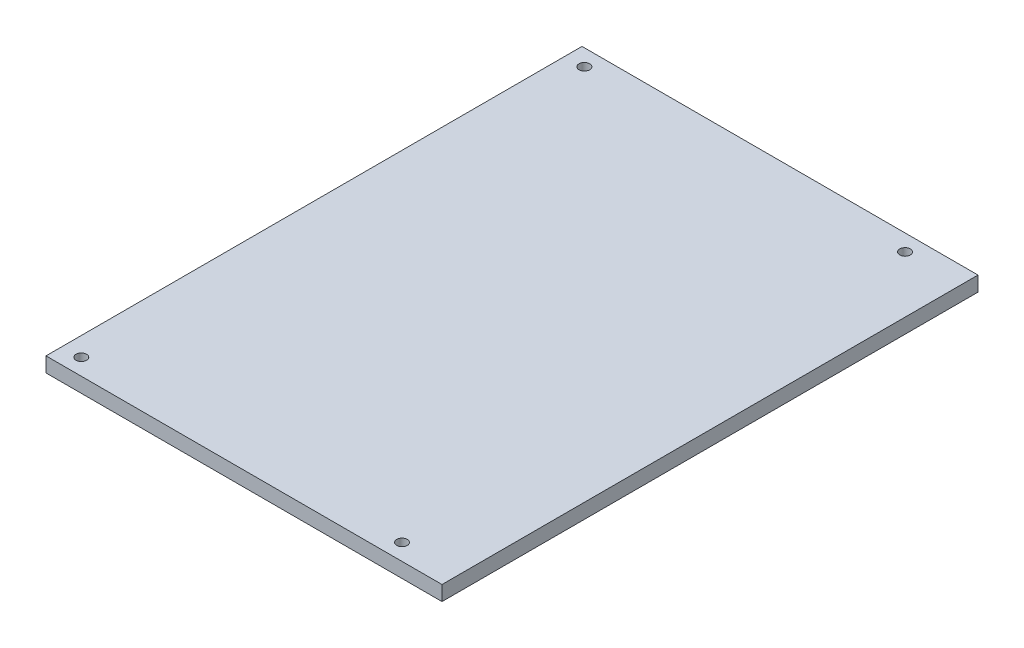
from build123d import *

# Parameters (mm, degrees)
SKETCH1_W           = 267.22
SKETCH1_H           = 361.68
SKETCH1_R           = 3.57
BOSS_EXTRUDE1_DEPTH = 10


with BuildPart() as part:
    # Sketch1 → Boss-Extrude1 (new body)
    with BuildSketch(Plane(origin=(0, 0, 0), x_dir=(1, 0, 0), z_dir=(0, 1, 0))):
        with Locations((-5.948680203, -14.948274112)):
            Rectangle(SKETCH1_W, SKETCH1_H)
        with Locations(Location((-126.858680203, -184.675774112, 0), (0, 0, 270))):
            Circle(SKETCH1_R, mode=Mode.SUBTRACT)
        with Locations(Location((-126.858680203, 154.779225888, 0), (0, 0, 270))):
            Circle(SKETCH1_R, mode=Mode.SUBTRACT)
        with Locations(Location((89.561319797, 154.779225888, 0), (0, 0, 270))):
            Circle(SKETCH1_R, mode=Mode.SUBTRACT)
        with Locations(Location((89.561319797, -184.675774112, 0), (0, 0, 270))):
            Circle(SKETCH1_R, mode=Mode.SUBTRACT)
    extrude(amount=BOSS_EXTRUDE1_DEPTH)


solid = part.part
